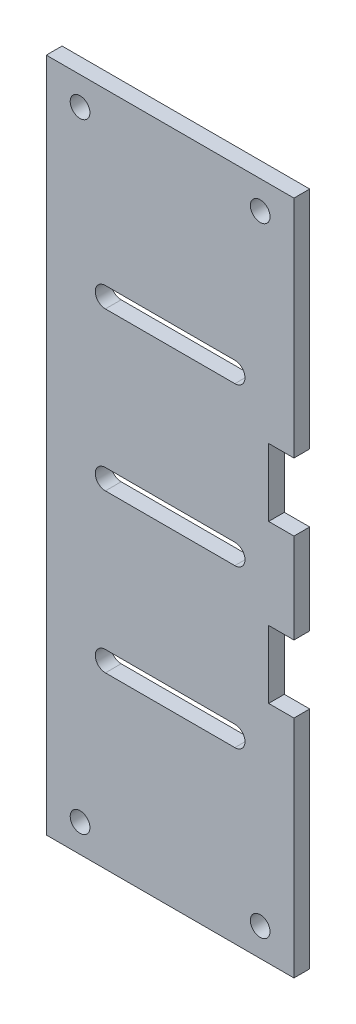
from build123d import *

# Parameters (mm, degrees)
COVER_WITH_CLAMP_HARDWARE_CLEARANCES_PRO_R = 1.75
COVER_WITH_CLAMP_HARDWARE_CLEARANCES_DEPTH = 2.8


with BuildPart() as part:
    # Cover with clamp hardware clearances profile → Cover with clamp hardware clearances (new body)
    with BuildSketch(Plane.XY):
        Polygon((-22, -60), (22, -60), (22, -20), (17.5, -20), (17.5, -8), (22, -8), (22, 8), (17.5, 8), (17.5, 20), (22, 20), (22, 60), (-22, 60), align=None)
        with Locations((-16, -55)):
            Circle(COVER_WITH_CLAMP_HARDWARE_CLEARANCES_PRO_R, mode=Mode.SUBTRACT)
        with Locations((-16, 55)):
            Circle(COVER_WITH_CLAMP_HARDWARE_CLEARANCES_PRO_R, mode=Mode.SUBTRACT)
        with Locations((16, -55)):
            Circle(COVER_WITH_CLAMP_HARDWARE_CLEARANCES_PRO_R, mode=Mode.SUBTRACT)
        with Locations((16, 55)):
            Circle(COVER_WITH_CLAMP_HARDWARE_CLEARANCES_PRO_R, mode=Mode.SUBTRACT)
        with BuildLine():
            Line((-11.5, -29.8), (11.5, -29.8))
            ThreePointArc((11.5, -29.8), (13.3, -28), (11.5, -26.2))
            Line((11.5, -26.2), (-11.5, -26.2))
            ThreePointArc((-11.5, -26.2), (-13.3, -28), (-11.5, -29.8))
        make_face(mode=Mode.SUBTRACT)
        with BuildLine():
            Line((-11.5, -1.8), (11.5, -1.8))
            ThreePointArc((11.5, -1.8), (13.3, 0), (11.5, 1.8))
            Line((11.5, 1.8), (-11.5, 1.8))
            ThreePointArc((-11.5, 1.8), (-13.3, 0), (-11.5, -1.8))
        make_face(mode=Mode.SUBTRACT)
        with BuildLine():
            Line((-11.5, 26.2), (11.5, 26.2))
            ThreePointArc((11.5, 26.2), (13.3, 28), (11.5, 29.8))
            Line((11.5, 29.8), (-11.5, 29.8))
            ThreePointArc((-11.5, 29.8), (-13.3, 28), (-11.5, 26.2))
        make_face(mode=Mode.SUBTRACT)
    extrude(amount=COVER_WITH_CLAMP_HARDWARE_CLEARANCES_DEPTH)


solid = part.part
